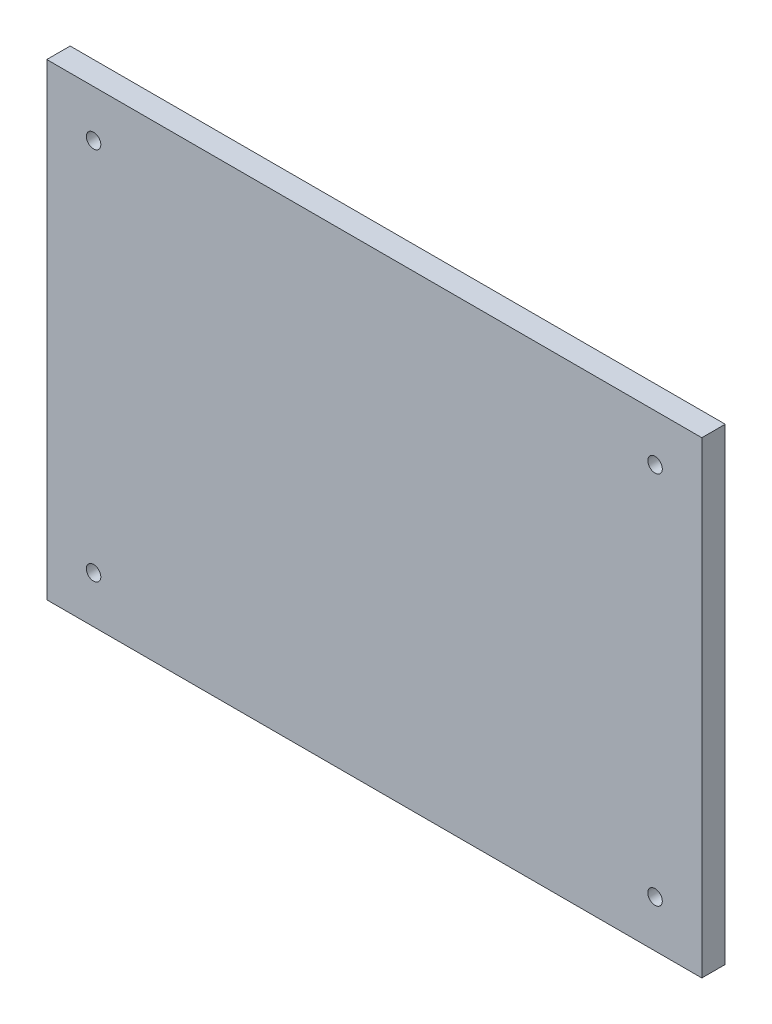
from build123d import *

# Parameters (mm, degrees)
ESQUISSE1_W        = 140
ESQUISSE1_H        = 100
ESQUISSE1_R        = 1.55
BOSS_EXTRU_1_DEPTH = 5


with BuildPart() as part:
    # Esquisse1 → Boss.-Extru.1 (new body)
    with BuildSketch(Plane.XY):
        Rectangle(ESQUISSE1_W, ESQUISSE1_H)
        with Locations((-60, -40)):
            Circle(ESQUISSE1_R, mode=Mode.SUBTRACT)
        with Locations(Location((60, -40, 0), (0, 0, 180))):
            Circle(ESQUISSE1_R, mode=Mode.SUBTRACT)
        with Locations((60, 40)):
            Circle(ESQUISSE1_R, mode=Mode.SUBTRACT)
        with Locations(Location((-60, 40, 0), (0, 0, 180))):
            Circle(ESQUISSE1_R, mode=Mode.SUBTRACT)
    extrude(amount=-BOSS_EXTRU_1_DEPTH)


solid = part.part
